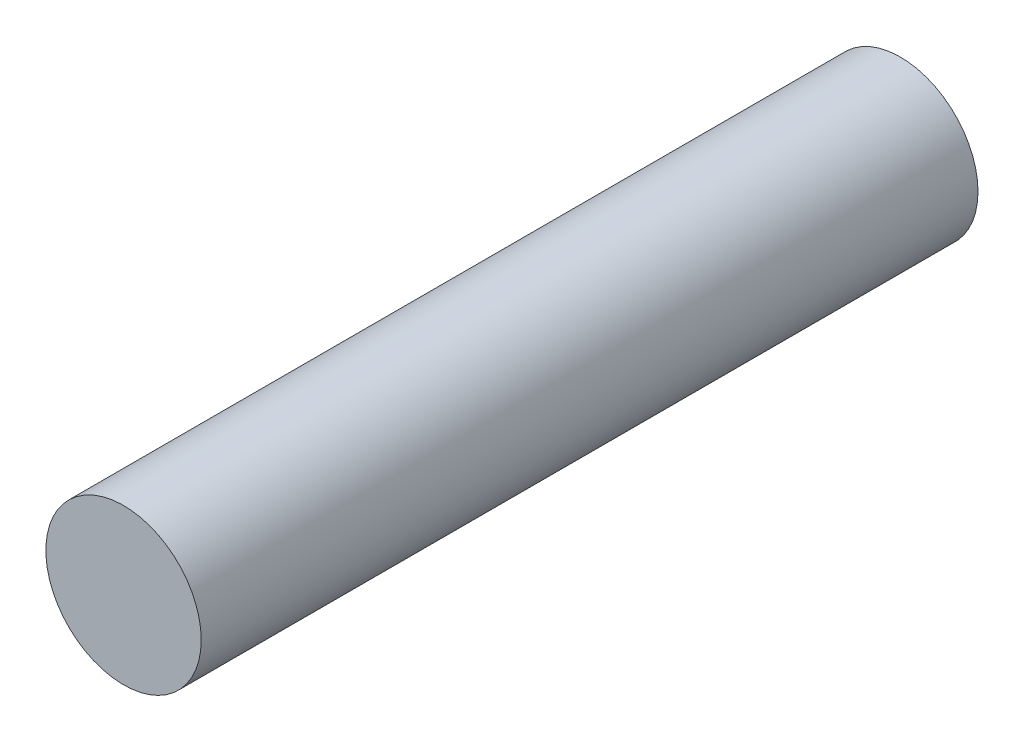
from build123d import *

# Parameters (mm, degrees)
SKETCH1_R           = 1.5875
BOSS_EXTRUDE1_DEPTH = 15.875


with BuildPart() as part:
    # Sketch1 → Boss-Extrude1 (new body)
    with BuildSketch(Plane.XY):
        Circle(SKETCH1_R)
    extrude(amount=BOSS_EXTRUDE1_DEPTH)


solid = part.part
